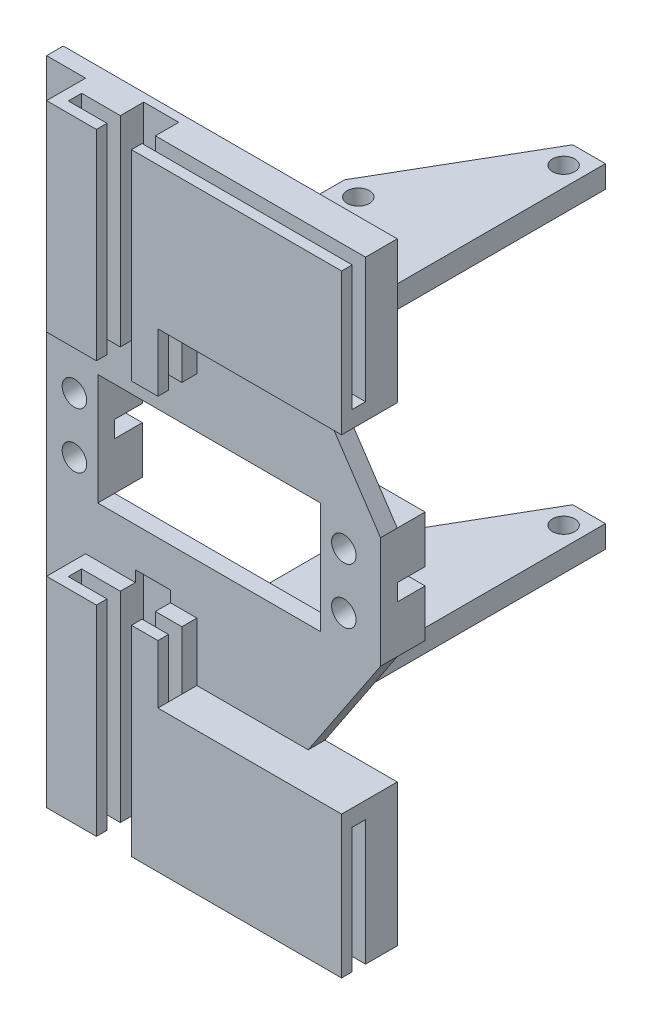
from build123d import *
from build123d.topology import SkipClean

# Parameters (mm, degrees)
SKETCH_1_R               = 2.2
EXTRUDE_1_DEPTH          = 1.5
EXTRUDE_START            = -1.5
EXTRUDE_2_DEPTH          = 10
SKETCH_2_W               = 6.3
SKETCH_2_H               = 7
CUT_EXTRUDE_1_DEPTH      = 80
CUT_EXTRUDE_START        = -2
SKETCH_3_W               = 2.4
SKETCH_3_H               = 19
CUT_EXTRUDE_2_DEPTH      = 80
EXTRUDE_3_DEPTH          = 10
SKETCH_4_W               = 17.75
SKETCH_4_H               = 2.4
CUT_EXTRUDE_3_DEPTH      = 12.5
CUT_EXTRUDE_START_2      = -90
SKETCH_4_2_W             = 17.75
SKETCH_4_2_H             = 2.4
CUT_EXTRUDE_4_DEPTH      = 12.5
EXTRUDE_START_2          = -15
SKETCH_6_R               = 2
EXTRUDE_4_DEPTH          = 4
EXTRUDE_START_3          = -71
SKETCH_6_2_R             = 2
EXTRUDE_5_DEPTH          = 4
CUT_EXTRUDE_START_3      = 60
SKETCH_7_W               = 6.95
SKETCH_7_H               = 2.4
CUT_EXTRUDE_5_DEPTH      = 90
SKETCH_9_W               = 6.3
SKETCH_9_H               = 1.5
CUT_EXTRUDE_7_DEPTH      = 23
SKETCH_10_W              = 6.3
SKETCH_10_H              = 1.5
CUT_EXTRUDE_8_DEPTH      = 23
CUT_EXTRUDE_9_DEPTH      = 70
CUT_EXTRUDE_9_DEPTH_BACK = 30
SKETCH_11_W              = 2.75
SKETCH_11_H              = 2.4
EXTRUDE_6_DEPTH          = 20
EXTRUDE_7_DEPTH          = 20
SKETCH_15_W              = 37.75
SKETCH_15_H              = 1.9
EXTRUDE_8_DEPTH          = 15
SKETCH_16_W              = 37.75
SKETCH_16_H              = 1.9
EXTRUDE_9_DEPTH          = 15
EXTRUDE_START_4          = 5
SKETCH_17_W              = 10.8
SKETCH_17_H              = 8.5
SKETCH_17_R              = 2.2
SKETCH_17_W_2            = 9.2
EXTRUDE_10_DEPTH         = 5


with BuildPart() as part:
    # 草图1 → 凸台-拉伸1 (new, symmetric)
    with BuildSketch(Plane.XY):
        Polygon((15.95, 38), (15.95, 19), (7, 19), (7, 40), (0, 40), (0, -40), (7, -40), (7, -19), (15.95, -19), (15.95, -38), (22.25, -38), (22.25, -19), (24.25, -19), (27, -19), (27, -29.5), (40, -29.5), (40, -40), (60, -10), (60, 10), (40, 40), (40, 29.5), (27, 29.5), (27, 19), (24.25, 19), (22.25, 19), (22.25, 38), align=None)
        with Locations((5, -5)):
            Circle(SKETCH_1_R, mode=Mode.SUBTRACT)
        with Locations((53.4, -5)):
            Circle(SKETCH_1_R, mode=Mode.SUBTRACT)
        with Locations((5, 5)):
            Circle(SKETCH_1_R, mode=Mode.SUBTRACT)
        Polygon((16, 10), (23, 10), (49.2, 10), (49.2, -10), (23, -10), (16, -10), (9.2, -10), (9.2, 10), align=None, mode=Mode.SUBTRACT)
        with Locations((53.4, 5)):
            Circle(SKETCH_1_R, mode=Mode.SUBTRACT)
    extrude(amount=EXTRUDE_1_DEPTH, both=True)

    # 草图1<3> → 凸台-拉伸2 (add)
    with BuildSketch(Plane.XY.offset(EXTRUDE_START)):
        Polygon((7, 19), (15.95, 19), (15.95, 38), (22.25, 38), (22.25, 19), (24.25, 19), (24.25, 40), (22.25, 40), (16.15, 40), (7, 40), align=None)
        Polygon((7, -19), (7, -40), (16.15, -40), (22.25, -40), (24.25, -40), (24.25, -19), (22.25, -19), (22.25, -38), (15.95, -38), (15.95, -19), align=None)
    extrude(amount=EXTRUDE_2_DEPTH)

    # 草图2 → 切除-拉伸1 (cut)
    with BuildSketch(Plane.XZ.offset(40)):
        with Locations((19.1, 5)):
            Rectangle(SKETCH_2_W, SKETCH_2_H)
    extrude(amount=-CUT_EXTRUDE_1_DEPTH, mode=Mode.SUBTRACT)

    # 草图3 → 切除-拉伸2 (cut)
    with BuildSketch(Plane.ZY.offset(-7).offset(CUT_EXTRUDE_START)):
        with Locations((5.4, -28.5)):
            Rectangle(SKETCH_3_W, SKETCH_3_H)
        with Locations((5.4, 28.5)):
            Rectangle(SKETCH_3_W, SKETCH_3_H)
    extrude(amount=-CUT_EXTRUDE_2_DEPTH, mode=Mode.SUBTRACT)

    # 草图1<4> → 凸台-拉伸3 (add)
    with BuildSketch(Plane.XY.offset(EXTRUDE_START)):
        Polygon((24.25, 45), (24.25, 19), (27, 19), (27, 29.5), (40, 29.5), (40, 45), align=None)
        Polygon((24.25, -19), (24.25, -45), (40, -45), (40, -29.5), (27, -29.5), (27, -19), align=None)
    extrude(amount=EXTRUDE_3_DEPTH)

    # 草图4 → 切除-拉伸3 (cut)
    with BuildSketch(Plane.XZ.offset(45)):
        with Locations((31.125, 5.4)):
            Rectangle(SKETCH_4_W, SKETCH_4_H)
    extrude(amount=-CUT_EXTRUDE_3_DEPTH, mode=Mode.SUBTRACT)

    # 草图4<2> → 切除-拉伸4 (cut)
    with BuildSketch(Plane.XZ.offset(45).offset(CUT_EXTRUDE_START_2)):
        with Locations((31.125, 5.4)):
            Rectangle(SKETCH_4_2_W, SKETCH_4_2_H)
    extrude(amount=CUT_EXTRUDE_4_DEPTH, mode=Mode.SUBTRACT)

    # 草图6 → 凸台-拉伸4 (add)
    with BuildSketch(Plane(origin=(0, 45, 0), x_dir=(1, 0, 0), z_dir=(0, 1, 0)).offset(EXTRUDE_START_2)):
        Polygon((21.0788144, 1.5), (42, 1.5), (42, 7.5), (42, 56.89407293), (36.129535456, 56.89407293), (21.0788144, 30.93796809), align=None)
        with Locations(Location((25, 29.5, 0), (0, 0, 270))):
            Circle(SKETCH_6_R, mode=Mode.SUBTRACT)
        with Locations(Location((38.5, 52.8826859, 0), (0, 0, 270))):
            Circle(SKETCH_6_R, mode=Mode.SUBTRACT)
    extrude(amount=-EXTRUDE_4_DEPTH)

    # 草图6<2> → 凸台-拉伸5 (add)
    with BuildSketch(Plane(origin=(0, 45, 0), x_dir=(1, 0, 0), z_dir=(0, 1, 0)).offset(EXTRUDE_START_3)):
        Polygon((21.0788144, 1.5), (42, 1.5), (42, 7.5), (42, 56.89407293), (36.129535456, 56.89407293), (21.0788144, 30.93796809), align=None)
        with Locations(Location((25, 29.5, 0), (0, 0, 270))):
            Circle(SKETCH_6_2_R, mode=Mode.SUBTRACT)
        with Locations(Location((38.5, 52.8826859, 0), (0, 0, 270))):
            Circle(SKETCH_6_2_R, mode=Mode.SUBTRACT)
    extrude(amount=-EXTRUDE_5_DEPTH)

    # 草图7 → 切除-拉伸5 (cut)
    with BuildSketch(Plane.XZ.offset(-19).offset(CUT_EXTRUDE_START_3)):
        with Locations((12.475, 5.4)):
            Rectangle(SKETCH_7_W, SKETCH_7_H)
    extrude(amount=-CUT_EXTRUDE_5_DEPTH, mode=Mode.SUBTRACT)

    # 草图9 → 切除-拉伸7 (cut)
    with BuildSketch(Plane(origin=(0, 40, 0), x_dir=(1, 0, 0), z_dir=(0, 1, 0))):
        with Locations((19.1, -0.75)):
            Rectangle(SKETCH_9_W, SKETCH_9_H)
    extrude(amount=-CUT_EXTRUDE_7_DEPTH, mode=Mode.SUBTRACT)

    # 草图10 → 切除-拉伸8 (cut)
    with BuildSketch(Plane.XZ.offset(40)):
        with Locations((19.1, 0.75)):
            Rectangle(SKETCH_10_W, SKETCH_10_H)
    extrude(amount=-CUT_EXTRUDE_8_DEPTH, mode=Mode.SUBTRACT)

    # 草图11 → 切除-拉伸9 (cut, two sides: drawn at the far end of the back side and taken through both)
    with BuildSketch(Plane.XZ.offset(-19).offset(-CUT_EXTRUDE_9_DEPTH_BACK)):
        with Locations((25.625, 5.4)):
            Rectangle(SKETCH_11_W, SKETCH_11_H)
    extrude(amount=CUT_EXTRUDE_9_DEPTH + CUT_EXTRUDE_9_DEPTH_BACK, mode=Mode.SUBTRACT)

    # 草图12 → 凸台-拉伸6 (add)
    with BuildSketch(Plane(origin=(40, 0, 0), x_dir=(0, 0, -1), z_dir=(1, 0, 0))):
        Polygon((-8.5, -45), (-8.5, -29.5), (1.5, -29.5), (1.5, -45), (-4.2, -45), (-4.2, -32.5), (-6.6, -32.5), (-6.6, -45), align=None)
    extrude(amount=EXTRUDE_6_DEPTH)

    # 草图13 → 凸台-拉伸7 (add)
    with BuildSketch(Plane(origin=(40, 0, 0), x_dir=(0, 0, -1), z_dir=(1, 0, 0))):
        Polygon((-8.5, 45), (-8.5, 29.5), (1.5, 29.5), (1.5, 45), (-4.2, 45), (-4.2, 32.5), (-6.6, 32.5), (-6.6, 45), align=None)
    extrude(amount=EXTRUDE_7_DEPTH)

    # 草图15 → 凸台-拉伸8 (add)
    with BuildSketch(Plane(origin=(0, 40, 0), x_dir=(1, 0, 0), z_dir=(0, 1, 0))):
        Polygon((0, -1.5), (7, -1.5), (7, -8.5), (15.95, -8.5), (15.95, -6.6), (9, -6.6), (9, -4.2), (15.95, -4.2), (15.95, 0), (22.25, 0), (22.25, -4.2), (60, -4.2), (60, 1.5), (0, 1.5), align=None)
        with Locations((41.125, -7.55)):
            Rectangle(SKETCH_15_W, SKETCH_15_H)
    extrude(amount=EXTRUDE_8_DEPTH)

    # 草图16 → 凸台-拉伸9 (add)
    with BuildSketch(Plane.XZ.offset(40)):
        Polygon((15.95, 8.5), (7, 8.5), (7, 1.5), (0, 1.5), (0, -1.5), (60, -1.5), (60, 4.2), (22.25, 4.2), (22.25, 0), (15.95, 0), (15.95, 4.2), (9, 4.2), (9, 6.6), (15.95, 6.6), align=None)
        with Locations((41.125, 7.55)):
            Rectangle(SKETCH_16_W, SKETCH_16_H)
    extrude(amount=EXTRUDE_9_DEPTH)

    # 草图17 → 凸台-拉伸10 (add)
    # profile 1 of 4: a face of its own
    with SkipClean():  # the faces are left unmerged after this step: merging them gives an invalid solid
        with BuildSketch(Plane(origin=(0, 0, -1.5), x_dir=(-1, 0, 0), z_dir=(0, 0, -1)).offset(EXTRUDE_START_4)):
            with Locations((-54.6, -5.75)):
                Rectangle(SKETCH_17_W, SKETCH_17_H)
            with Locations((-53.4, -5)):
                Circle(SKETCH_17_R, mode=Mode.SUBTRACT)
        # profile 2 of 4: a face of its own
        with BuildSketch(Plane(origin=(0, 0, -1.5), x_dir=(-1, 0, 0), z_dir=(0, 0, -1)).offset(EXTRUDE_START_4)):
            with Locations((-54.6, 5.75)):
                Rectangle(SKETCH_17_W, SKETCH_17_H)
            with Locations((-53.4, 5)):
                Circle(SKETCH_17_R, mode=Mode.SUBTRACT)
        # profile 3 of 4: a face of its own
        with BuildSketch(Plane(origin=(0, 0, -1.5), x_dir=(-1, 0, 0), z_dir=(0, 0, -1)).offset(EXTRUDE_START_4)):
            with Locations((-4.6, -5.75)):
                Rectangle(SKETCH_17_W_2, SKETCH_17_H)
            with Locations((-5, -5)):
                Circle(SKETCH_17_R, mode=Mode.SUBTRACT)
        # profile 4 of 4: a face of its own
        with BuildSketch(Plane(origin=(0, 0, -1.5), x_dir=(-1, 0, 0), z_dir=(0, 0, -1)).offset(EXTRUDE_START_4)):
            with Locations((-4.6, 5.75)):
                Rectangle(SKETCH_17_W_2, SKETCH_17_H)
            with Locations((-5, 5)):
                Circle(SKETCH_17_R, mode=Mode.SUBTRACT)
        extrude(amount=-EXTRUDE_10_DEPTH)


solid = part.part
